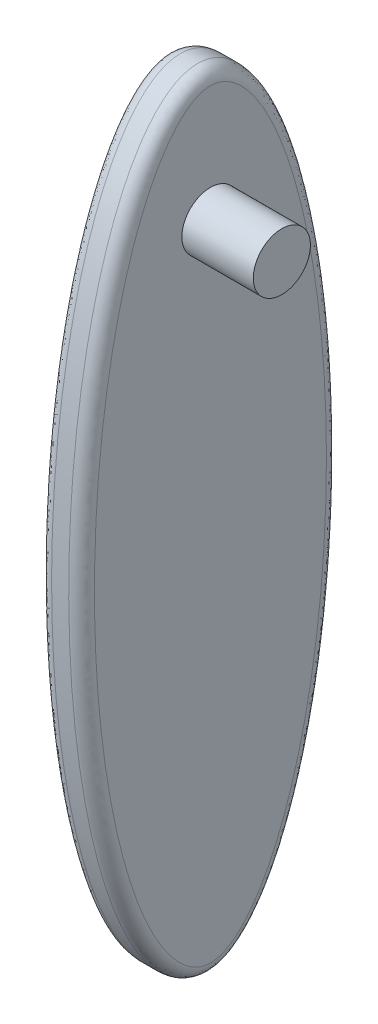
from build123d import *

# Parameters (mm, degrees)
SKETCH2_RX          = 27.489278617
SKETCH2_RY          = 9.020162911
BOSS_EXTRUDE2_DEPTH = 3
FILLET2_R           = 0.9
SKETCH3_R           = 2
BOSS_EXTRUDE3_DEPTH = 8


with BuildPart() as part:
    # Sketch2 → Boss-Extrude2 (new body)
    with BuildSketch(Plane(origin=(0, 0, 0), x_dir=(0, 0, -1), z_dir=(1, 0, 0))):
        with Locations(Location((0, 0), (0, 0, -90))):
            Ellipse(SKETCH2_RX, SKETCH2_RY)
    extrude(amount=BOSS_EXTRUDE2_DEPTH)

    # Fillet2
    fillet2_edges = [part.edges().sort_by_distance(p)[0] for p in [
        (0, 27.475941738, 0.280945539),
        (3, 27.475941738, 0.280945539),
    ]]
    fillet(fillet2_edges, radius=FILLET2_R)

    # Sketch3 → Boss-Extrude3 (add)
    with BuildSketch(Plane(origin=(0, 0, 0), x_dir=(0, 0, -1), z_dir=(1, 0, 0))):
        with Locations((0, 18.426854194)):
            Circle(SKETCH3_R)
    extrude(amount=BOSS_EXTRUDE3_DEPTH)


solid = part.part
